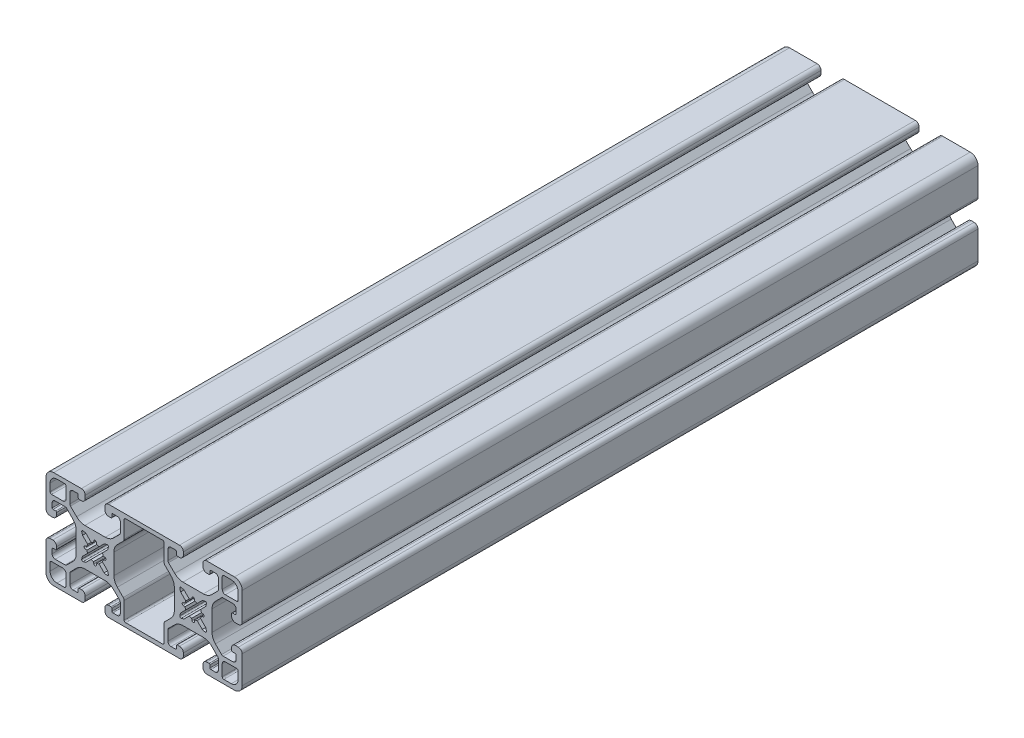
from build123d import *

# Parameters (mm, degrees)
EXTRUDE1_DEPTH = 300


with BuildPart() as part:
    # Sketch1 → Extrude1 (new body)
    with BuildSketch(Plane.XY):
        with BuildLine():
            Line((-44, -18.484793301), (-44, -17.255))
            ThreePointArc((-44, -17.255), (-44.459842354, -16.144842354), (-45.57, -15.685))
            Line((-45.57, -15.685), (-46.474, -15.685))
            ThreePointArc((-46.474, -15.685), (-46.743407684, -15.796592316), (-46.855, -16.066))
            Line((-46.855, -16.066), (-46.855, -17.119))
            ThreePointArc((-46.855, -17.119), (-46.966592316, -17.388407684), (-47.236, -17.5))
            Line((-47.236, -17.5), (-49.015, -17.5))
            ThreePointArc((-49.015, -17.5), (-49.913025612, -17.128025612), (-50.285, -16.23))
            Line((-50.285, -16.23), (-50.285, -12.216214636))
            ThreePointArc((-50.285, -12.216214636), (-50.217252784, -11.875626381), (-50.024325035, -11.5868896))
            Line((-50.024325035, -11.5868896), (-47.513678224, -9.076242789))
            ThreePointArc((-47.513678224, -9.076242789), (-45.972667317, -8.046572221), (-44.154921014, -7.685))
            Line((-44.154921014, -7.685), (-35.845078986, -7.685))
            ThreePointArc((-35.845078986, -7.685), (-34.027332683, -8.046572221), (-32.486321776, -9.076242789))
            Line((-32.486321776, -9.076242789), (-29.975674965, -11.5868896))
            ThreePointArc((-29.975674965, -11.5868896), (-29.782747216, -11.875626381), (-29.715, -12.216214636))
            Line((-29.715, -12.216214636), (-29.715, -16.23))
            ThreePointArc((-29.715, -16.23), (-30.086974388, -17.128025612), (-30.985, -17.5))
            Line((-30.985, -17.5), (-32.764, -17.5))
            ThreePointArc((-32.764, -17.5), (-33.033407684, -17.388407684), (-33.145, -17.119))
            Line((-33.145, -17.119), (-33.145, -16.066))
            ThreePointArc((-33.145, -16.066), (-33.256592316, -15.796592316), (-33.526, -15.685))
            Line((-33.526, -15.685), (-34.43, -15.685))
            ThreePointArc((-34.43, -15.685), (-35.540157646, -16.144842354), (-36, -17.255))
            Line((-36, -17.255), (-36, -18.484793301))
            ThreePointArc((-36, -18.484793301), (-35.521569689, -19.559363866), (-34.43095644, -20))
            Line((-34.43095644, -20), (-5.57, -20))
            ThreePointArc((-5.57, -20), (-4.459842354, -19.540157646), (-4, -18.43))
            Line((-4, -18.43), (-4, -17.255))
            ThreePointArc((-4, -17.255), (-4.459842354, -16.144842354), (-5.57, -15.685))
            Line((-5.57, -15.685), (-6.474, -15.685))
            ThreePointArc((-6.474, -15.685), (-6.743407684, -15.796592316), (-6.855, -16.066))
            Line((-6.855, -16.066), (-6.855, -17.119))
            ThreePointArc((-6.855, -17.119), (-6.966592316, -17.388407684), (-7.236, -17.5))
            Line((-7.236, -17.5), (-9.015, -17.5))
            ThreePointArc((-9.015, -17.5), (-9.913025612, -17.128025612), (-10.285, -16.23))
            Line((-10.285, -16.23), (-10.285, -12.216214636))
            ThreePointArc((-10.285, -12.216214636), (-10.217252784, -11.875626381), (-10.024325035, -11.5868896))
            Line((-10.024325035, -11.5868896), (-7.513678224, -9.076242789))
            ThreePointArc((-7.513678224, -9.076242789), (-5.972667317, -8.046572221), (-4.154921014, -7.685))
            Line((-4.154921014, -7.685), (4.154921014, -7.685))
            ThreePointArc((4.154921014, -7.685), (5.972667317, -8.046572221), (7.513678224, -9.076242789))
            Line((7.513678224, -9.076242789), (10.024325035, -11.5868896))
            ThreePointArc((10.024325035, -11.5868896), (10.217252784, -11.875626381), (10.285, -12.216214636))
            Line((10.285, -12.216214636), (10.285, -16.23))
            ThreePointArc((10.285, -16.23), (9.913025612, -17.128025612), (9.015, -17.5))
            Line((9.015, -17.5), (7.236, -17.5))
            ThreePointArc((7.236, -17.5), (6.966592316, -17.388407684), (6.855, -17.119))
            Line((6.855, -17.119), (6.855, -16.066))
            ThreePointArc((6.855, -16.066), (6.743407684, -15.796592316), (6.474, -15.685))
            Line((6.474, -15.685), (5.57, -15.685))
            ThreePointArc((5.57, -15.685), (4.459842354, -16.144842354), (4, -17.255))
            Line((4, -17.255), (4, -18.43))
            ThreePointArc((4, -18.43), (4.459842354, -19.540157646), (5.57, -20))
            Line((5.57, -20), (16.83, -20))
            ThreePointArc((16.83, -20), (19.071528496, -19.071528496), (20, -16.83))
            Line((20, -16.83), (20, -5.57))
            ThreePointArc((20, -5.57), (19.540157646, -4.459842354), (18.43, -4))
            Line((18.43, -4), (17.255, -4))
            ThreePointArc((17.255, -4), (16.144842354, -4.459842354), (15.685, -5.57))
            Line((15.685, -5.57), (15.685, -6.474))
            ThreePointArc((15.685, -6.474), (15.796592316, -6.743407684), (16.066, -6.855))
            Line((16.066, -6.855), (17.119, -6.855))
            ThreePointArc((17.119, -6.855), (17.388407684, -6.966592316), (17.5, -7.236))
            Line((17.5, -7.236), (17.5, -9.015))
            ThreePointArc((17.5, -9.015), (17.128025612, -9.913025612), (16.23, -10.285))
            Line((16.23, -10.285), (12.216214636, -10.285))
            ThreePointArc((12.216214636, -10.285), (11.875626381, -10.217252784), (11.5868896, -10.024325035))
            Line((11.5868896, -10.024325035), (9.076242789, -7.513678224))
            ThreePointArc((9.076242789, -7.513678224), (8.046572221, -5.972667317), (7.685, -4.154921014))
            Line((7.685, -4.154921014), (7.685, 4.154921014))
            ThreePointArc((7.685, 4.154921014), (8.046572221, 5.972667317), (9.076242789, 7.513678224))
            Line((9.076242789, 7.513678224), (11.5868896, 10.024325035))
            ThreePointArc((11.5868896, 10.024325035), (11.875626381, 10.217252784), (12.216214636, 10.285))
            Line((12.216214636, 10.285), (16.23, 10.285))
            ThreePointArc((16.23, 10.285), (17.128025612, 9.913025612), (17.5, 9.015))
            Line((17.5, 9.015), (17.5, 7.236))
            ThreePointArc((17.5, 7.236), (17.388407684, 6.966592316), (17.119, 6.855))
            Line((17.119, 6.855), (16.066, 6.855))
            ThreePointArc((16.066, 6.855), (15.796592316, 6.743407684), (15.685, 6.474))
            Line((15.685, 6.474), (15.685, 5.57))
            ThreePointArc((15.685, 5.57), (16.144842354, 4.459842354), (17.255, 4))
            Line((17.255, 4), (18.43, 4))
            ThreePointArc((18.43, 4), (19.540157646, 4.459842354), (20, 5.57))
            Line((20, 5.57), (20, 16.83))
            ThreePointArc((20, 16.83), (19.071528496, 19.071528496), (16.83, 20))
            Line((16.83, 20), (5.57, 20))
            ThreePointArc((5.57, 20), (4.459842354, 19.540157646), (4, 18.43))
            Line((4, 18.43), (4, 17.255))
            ThreePointArc((4, 17.255), (4.459842354, 16.144842354), (5.57, 15.685))
            Line((5.57, 15.685), (6.474, 15.685))
            ThreePointArc((6.474, 15.685), (6.743407684, 15.796592316), (6.855, 16.066))
            Line((6.855, 16.066), (6.855, 17.119))
            ThreePointArc((6.855, 17.119), (6.966592316, 17.388407684), (7.236, 17.5))
            Line((7.236, 17.5), (9.015, 17.5))
            ThreePointArc((9.015, 17.5), (9.913025612, 17.128025612), (10.285, 16.23))
            Line((10.285, 16.23), (10.285, 12.216214636))
            ThreePointArc((10.285, 12.216214636), (10.217252784, 11.875626381), (10.024325035, 11.5868896))
            Line((10.024325035, 11.5868896), (7.513678224, 9.076242789))
            ThreePointArc((7.513678224, 9.076242789), (5.972667317, 8.046572221), (4.154921014, 7.685))
            Line((4.154921014, 7.685), (-4.154921014, 7.685))
            ThreePointArc((-4.154921014, 7.685), (-5.972667317, 8.046572221), (-7.513678224, 9.076242789))
            Line((-7.513678224, 9.076242789), (-10.024325035, 11.5868896))
            ThreePointArc((-10.024325035, 11.5868896), (-10.217252784, 11.875626381), (-10.285, 12.216214636))
            Line((-10.285, 12.216214636), (-10.285, 16.23))
            ThreePointArc((-10.285, 16.23), (-9.913025612, 17.128025612), (-9.015, 17.5))
            Line((-9.015, 17.5), (-7.236, 17.5))
            ThreePointArc((-7.236, 17.5), (-6.966592316, 17.388407684), (-6.855, 17.119))
            Line((-6.855, 17.119), (-6.855, 16.066))
            ThreePointArc((-6.855, 16.066), (-6.743407684, 15.796592316), (-6.474, 15.685))
            Line((-6.474, 15.685), (-5.57, 15.685))
            ThreePointArc((-5.57, 15.685), (-4.459842354, 16.144842354), (-4, 17.255))
            Line((-4, 17.255), (-4, 18.43))
            ThreePointArc((-4, 18.43), (-4.459842354, 19.540157646), (-5.57, 20))
            Line((-5.57, 20), (-34.43, 20))
            ThreePointArc((-34.43, 20), (-35.540157646, 19.540157646), (-36, 18.43))
            Line((-36, 18.43), (-36, 17.255))
            ThreePointArc((-36, 17.255), (-35.540157646, 16.144842354), (-34.43, 15.685))
            Line((-34.43, 15.685), (-33.526, 15.685))
            ThreePointArc((-33.526, 15.685), (-33.256592316, 15.796592316), (-33.145, 16.066))
            Line((-33.145, 16.066), (-33.145, 17.119))
            ThreePointArc((-33.145, 17.119), (-33.033407684, 17.388407684), (-32.764, 17.5))
            Line((-32.764, 17.5), (-30.985, 17.5))
            ThreePointArc((-30.985, 17.5), (-30.086974388, 17.128025612), (-29.715, 16.23))
            Line((-29.715, 16.23), (-29.715, 12.216214636))
            ThreePointArc((-29.715, 12.216214636), (-29.782747216, 11.875626381), (-29.975674965, 11.5868896))
            Line((-29.975674965, 11.5868896), (-32.486321776, 9.076242789))
            ThreePointArc((-32.486321776, 9.076242789), (-34.027332683, 8.046572221), (-35.845078986, 7.685))
            Line((-35.845078986, 7.685), (-44.154921014, 7.685))
            ThreePointArc((-44.154921014, 7.685), (-45.972667317, 8.046572221), (-47.513678224, 9.076242789))
            Line((-47.513678224, 9.076242789), (-50.024325035, 11.5868896))
            ThreePointArc((-50.024325035, 11.5868896), (-50.217252784, 11.875626381), (-50.285, 12.216214636))
            Line((-50.285, 12.216214636), (-50.285, 16.23))
            ThreePointArc((-50.285, 16.23), (-49.913025612, 17.128025612), (-49.015, 17.5))
            Line((-49.015, 17.5), (-47.236, 17.5))
            ThreePointArc((-47.236, 17.5), (-46.966592316, 17.388407684), (-46.855, 17.119))
            Line((-46.855, 17.119), (-46.855, 16.066))
            ThreePointArc((-46.855, 16.066), (-46.743407684, 15.796592316), (-46.474, 15.685))
            Line((-46.474, 15.685), (-45.57, 15.685))
            ThreePointArc((-45.57, 15.685), (-44.459842354, 16.144842354), (-44, 17.255))
            Line((-44, 17.255), (-44, 18.43))
            ThreePointArc((-44, 18.43), (-44.459842354, 19.540157646), (-45.57, 20))
            Line((-45.57, 20), (-56.83, 20))
            ThreePointArc((-56.83, 20), (-59.071528496, 19.071528496), (-60, 16.83))
            Line((-60, 16.83), (-60, 5.57))
            ThreePointArc((-60, 5.57), (-59.540157646, 4.459842354), (-58.43, 4))
            Line((-58.43, 4), (-57.255, 4))
            ThreePointArc((-57.255, 4), (-56.144842354, 4.459842354), (-55.685, 5.57))
            Line((-55.685, 5.57), (-55.685, 6.474))
            ThreePointArc((-55.685, 6.474), (-55.796592316, 6.743407684), (-56.066, 6.855))
            Line((-56.066, 6.855), (-57.119, 6.855))
            ThreePointArc((-57.119, 6.855), (-57.388407684, 6.966592316), (-57.5, 7.236))
            Line((-57.5, 7.236), (-57.5, 9.015))
            ThreePointArc((-57.5, 9.015), (-57.128025612, 9.913025612), (-56.23, 10.285))
            Line((-56.23, 10.285), (-52.216214636, 10.285))
            ThreePointArc((-52.216214636, 10.285), (-51.875626381, 10.217252784), (-51.5868896, 10.024325035))
            Line((-51.5868896, 10.024325035), (-49.076242789, 7.513678224))
            ThreePointArc((-49.076242789, 7.513678224), (-48.046572221, 5.972667317), (-47.685, 4.154921014))
            Line((-47.685, 4.154921014), (-47.685, -4.154921014))
            ThreePointArc((-47.685, -4.154921014), (-48.046572221, -5.972667317), (-49.076242789, -7.513678224))
            Line((-49.076242789, -7.513678224), (-51.5868896, -10.024325035))
            ThreePointArc((-51.5868896, -10.024325035), (-51.875626381, -10.217252784), (-52.216214636, -10.285))
            Line((-52.216214636, -10.285), (-56.23, -10.285))
            ThreePointArc((-56.23, -10.285), (-57.128025612, -9.913025612), (-57.5, -9.015))
            Line((-57.5, -9.015), (-57.5, -7.236))
            ThreePointArc((-57.5, -7.236), (-57.388407684, -6.966592316), (-57.119, -6.855))
            Line((-57.119, -6.855), (-56.066, -6.855))
            ThreePointArc((-56.066, -6.855), (-55.796592316, -6.743407684), (-55.685, -6.474))
            Line((-55.685, -6.474), (-55.685, -5.57))
            ThreePointArc((-55.685, -5.57), (-56.144842354, -4.459842354), (-57.255, -4))
            Line((-57.255, -4), (-58.43, -4))
            ThreePointArc((-58.43, -4), (-59.540157646, -4.459842354), (-60, -5.57))
            Line((-60, -5.57), (-60, -16.83))
            ThreePointArc((-60, -16.83), (-59.071528496, -19.071528496), (-56.83, -20))
            Line((-56.83, -20), (-45.56904356, -20))
            ThreePointArc((-45.56904356, -20), (-44.478430311, -19.559363866), (-44, -18.484793301))
        make_face()
        with BuildLine():
            Line((15.545, -18.345), (12.4898, -18.345))
            ThreePointArc((12.4898, -18.345), (12.044322728, -18.160477272), (11.8598, -17.715))
            Line((11.8598, -17.715), (11.8598, -13.1298))
            ThreePointArc((11.8598, -13.1298), (12.231774388, -12.231774388), (13.1298, -11.8598))
            Line((13.1298, -11.8598), (17.715, -11.8598))
            ThreePointArc((17.715, -11.8598), (18.160477272, -12.044322728), (18.345, -12.4898))
            Line((18.345, -12.4898), (18.345, -15.545))
            ThreePointArc((18.345, -15.545), (17.524898987, -17.524898987), (15.545, -18.345))
        make_face(mode=Mode.SUBTRACT)
        with BuildLine():
            Line((-11.8598, 17.715), (-11.8598, 10.823286659))
            ThreePointArc((-11.8598, 10.823286659), (-11.763127006, 10.3372787), (-11.487825612, 9.925261047))
            Line((-11.487825612, 9.925261047), (-9.076242789, 7.513678224))
            ThreePointArc((-9.076242789, 7.513678224), (-8.046572221, 5.972667317), (-7.685, 4.154921014))
            Line((-7.685, 4.154921014), (-7.685, -4.154921014))
            ThreePointArc((-7.685, -4.154921014), (-8.046572221, -5.972667317), (-9.076242789, -7.513678224))
            Line((-9.076242789, -7.513678224), (-11.487825612, -9.925261047))
            ThreePointArc((-11.487825612, -9.925261047), (-11.763127006, -10.3372787), (-11.8598, -10.823286659))
            Line((-11.8598, -10.823286659), (-11.8598, -17.715))
            ThreePointArc((-11.8598, -17.715), (-12.044322728, -18.160477272), (-12.4898, -18.345))
            Line((-12.4898, -18.345), (-27.5102, -18.345))
            ThreePointArc((-27.5102, -18.345), (-27.955677272, -18.160477272), (-28.1402, -17.715))
            Line((-28.1402, -17.715), (-28.1402, -10.823286659))
            ThreePointArc((-28.1402, -10.823286659), (-28.236872994, -10.3372787), (-28.512174388, -9.925261047))
            Line((-28.512174388, -9.925261047), (-30.923757211, -7.513678224))
            ThreePointArc((-30.923757211, -7.513678224), (-31.953427779, -5.972667317), (-32.315, -4.154921014))
            Line((-32.315, -4.154921014), (-32.315, 4.154921014))
            ThreePointArc((-32.315, 4.154921014), (-31.953427779, 5.972667317), (-30.923757211, 7.513678224))
            Line((-30.923757211, 7.513678224), (-28.512174388, 9.925261047))
            ThreePointArc((-28.512174388, 9.925261047), (-28.236872994, 10.3372787), (-28.1402, 10.823286659))
            Line((-28.1402, 10.823286659), (-28.1402, 17.715))
            ThreePointArc((-28.1402, 17.715), (-27.955677272, 18.160477272), (-27.5102, 18.345))
            Line((-27.5102, 18.345), (-12.4898, 18.345))
            ThreePointArc((-12.4898, 18.345), (-12.044322728, 18.160477272), (-11.8598, 17.715))
        make_face(mode=Mode.SUBTRACT)
        with BuildLine():
            Line((-58.345, -15.545), (-58.345, -12.4898))
            ThreePointArc((-58.345, -12.4898), (-58.160477272, -12.044322728), (-57.715, -11.8598))
            Line((-57.715, -11.8598), (-53.1298, -11.8598))
            ThreePointArc((-53.1298, -11.8598), (-52.231774388, -12.231774388), (-51.8598, -13.1298))
            Line((-51.8598, -13.1298), (-51.8598, -17.715))
            ThreePointArc((-51.8598, -17.715), (-52.044322728, -18.160477272), (-52.4898, -18.345))
            Line((-52.4898, -18.345), (-55.545, -18.345))
            ThreePointArc((-55.545, -18.345), (-57.524898987, -17.524898987), (-58.345, -15.545))
        make_face(mode=Mode.SUBTRACT)
        with BuildLine():
            Line((-55.545, 18.345), (-52.4898, 18.345))
            ThreePointArc((-52.4898, 18.345), (-52.044322728, 18.160477272), (-51.8598, 17.715))
            Line((-51.8598, 17.715), (-51.8598, 13.1298))
            ThreePointArc((-51.8598, 13.1298), (-52.231774388, 12.231774388), (-53.1298, 11.8598))
            Line((-53.1298, 11.8598), (-57.715, 11.8598))
            ThreePointArc((-57.715, 11.8598), (-58.160477272, 12.044322728), (-58.345, 12.4898))
            Line((-58.345, 12.4898), (-58.345, 15.545))
            ThreePointArc((-58.345, 15.545), (-57.524898987, 17.524898987), (-55.545, 18.345))
        make_face(mode=Mode.SUBTRACT)
        with BuildLine():
            Line((18.345, 15.545), (18.345, 12.4898))
            ThreePointArc((18.345, 12.4898), (18.160477272, 12.044322728), (17.715, 11.8598))
            Line((17.715, 11.8598), (13.1298, 11.8598))
            ThreePointArc((13.1298, 11.8598), (12.231774388, 12.231774388), (11.8598, 13.1298))
            Line((11.8598, 13.1298), (11.8598, 17.715))
            ThreePointArc((11.8598, 17.715), (12.044322728, 18.160477272), (12.4898, 18.345))
            Line((12.4898, 18.345), (15.545, 18.345))
            ThreePointArc((15.545, 18.345), (17.524898987, 17.524898987), (18.345, 15.545))
        make_face(mode=Mode.SUBTRACT)
        with BuildLine():
            Line((-34.873747818, -3.712038616), (-34.560690261, -4.84811685))
            ThreePointArc((-34.560690261, -4.84811685), (-34.696699139, -5.303300857), (-35.151883146, -5.43930974))
            Line((-35.151883146, -5.43930974), (-36.28796138, -5.126252183))
            Line((-36.28796138, -5.126252183), (-38.409281723, -3.00493184))
            ThreePointArc((-38.409281723, -3.00493184), (-38.879390357, -3.210020877), (-39.375, -3.34206149))
            Line((-39.375, -3.34206149), (-39.507740766, -4.087640441))
            ThreePointArc((-39.507740766, -4.087640441), (-40, -4.5), (-40.492259234, -4.087640441))
            Line((-40.492259234, -4.087640441), (-40.625, -3.34206149))
            ThreePointArc((-40.625, -3.34206149), (-41.120609643, -3.210020877), (-41.590718277, -3.00493184))
            Line((-41.590718277, -3.00493184), (-43.71203862, -5.126252183))
            Line((-43.71203862, -5.126252183), (-44.848116854, -5.43930974))
            ThreePointArc((-44.848116854, -5.43930974), (-45.303300871, -5.303300847), (-45.439309734, -4.848116822))
            Line((-45.439309734, -4.848116822), (-45.126252208, -3.712038579))
            Line((-45.126252208, -3.712038579), (-43.004931858, -1.590718243))
            ThreePointArc((-43.004931858, -1.590718243), (-43.210020883, -1.120609625), (-43.34206149, -0.625))
            Line((-43.34206149, -0.625), (-44.087640441, -0.492259234))
            ThreePointArc((-44.087640441, -0.492259234), (-44.5, 0), (-44.087640441, 0.492259234))
            Line((-44.087640441, 0.492259234), (-43.34206149, 0.625))
            ThreePointArc((-43.34206149, 0.625), (-43.210020877, 1.120609643), (-43.00493184, 1.590718277))
            Line((-43.00493184, 1.590718277), (-45.126252183, 3.71203862))
            Line((-45.126252183, 3.71203862), (-45.43930974, 4.848116854))
            ThreePointArc((-45.43930974, 4.848116854), (-45.303300847, 5.303300871), (-44.848116822, 5.439309734))
            Line((-44.848116822, 5.439309734), (-43.712038579, 5.126252209))
            Line((-43.712038579, 5.126252209), (-41.590718243, 3.004931858))
            ThreePointArc((-41.590718243, 3.004931858), (-41.120609625, 3.210020883), (-40.625, 3.34206149))
            Line((-40.625, 3.34206149), (-40.492259234, 4.087640441))
            ThreePointArc((-40.492259234, 4.087640441), (-40, 4.5), (-39.507740766, 4.087640441))
            Line((-39.507740766, 4.087640441), (-39.375, 3.34206149))
            ThreePointArc((-39.375, 3.34206149), (-38.879390364, 3.210020879), (-38.409281735, 3.004931846))
            Line((-38.409281735, 3.004931846), (-36.287961384, 5.126252182))
            Line((-36.287961384, 5.126252182), (-35.15188315, 5.43930974))
            ThreePointArc((-35.15188315, 5.43930974), (-34.696699143, 5.303300861), (-34.56069026, 4.848116854))
            Line((-34.56069026, 4.848116854), (-34.873747817, 3.71203862))
            Line((-34.873747817, 3.71203862), (-36.99506816, 1.590718277))
            ThreePointArc((-36.99506816, 1.590718277), (-36.789979123, 1.120609643), (-36.65793851, 0.625))
            Line((-36.65793851, 0.625), (-35.912359559, 0.492259234))
            ThreePointArc((-35.912359559, 0.492259234), (-35.5, 0), (-35.912359559, -0.492259234))
            Line((-35.912359559, -0.492259234), (-36.65793851, -0.625))
            ThreePointArc((-36.65793851, -0.625), (-36.789979121, -1.120609636), (-36.995068154, -1.590718265))
            Line((-36.995068154, -1.590718265), (-34.873747818, -3.712038616))
        make_face(mode=Mode.SUBTRACT)
        with BuildLine():
            Line((5.126252183, -3.712038621), (5.43930974, -4.848116855))
            ThreePointArc((5.43930974, -4.848116855), (5.303300859, -5.303300859), (4.848116855, -5.439309741))
            Line((4.848116855, -5.439309741), (3.712038621, -5.126252182))
            Line((3.712038621, -5.126252182), (1.590718278, -3.00493184))
            ThreePointArc((1.590718278, -3.00493184), (1.120609643, -3.210020877), (0.625, -3.34206149))
            Line((0.625, -3.34206149), (0.492259234, -4.087640441))
            ThreePointArc((0.492259234, -4.087640441), (0, -4.5), (-0.492259234, -4.087640441))
            Line((-0.492259234, -4.087640441), (-0.625, -3.34206149))
            ThreePointArc((-0.625, -3.34206149), (-1.120609643, -3.210020877), (-1.590718277, -3.00493184))
            Line((-1.590718277, -3.00493184), (-3.71203862, -5.126252183))
            Line((-3.71203862, -5.126252183), (-4.848116854, -5.43930974))
            ThreePointArc((-4.848116854, -5.43930974), (-5.30330086, -5.30330086), (-5.439309742, -4.848116855))
            Line((-5.439309742, -4.848116855), (-5.126252183, -3.712038621))
            Line((-5.126252183, -3.712038621), (-3.004931839, -1.590718279))
            ThreePointArc((-3.004931839, -1.590718279), (-3.210020876, -1.120609644), (-3.34206149, -0.625))
            Line((-3.34206149, -0.625), (-4.087640441, -0.492259234))
            ThreePointArc((-4.087640441, -0.492259234), (-4.5, 0), (-4.087640441, 0.492259234))
            Line((-4.087640441, 0.492259234), (-3.34206149, 0.625))
            ThreePointArc((-3.34206149, 0.625), (-3.210020877, 1.120609643), (-3.00493184, 1.590718277))
            Line((-3.00493184, 1.590718277), (-5.126252183, 3.71203862))
            Line((-5.126252183, 3.71203862), (-5.439309741, 4.848116854))
            ThreePointArc((-5.439309741, 4.848116854), (-5.303300859, 5.303300859), (-4.848116854, 5.43930974))
            Line((-4.848116854, 5.43930974), (-3.712038621, 5.126252183))
            Line((-3.712038621, 5.126252183), (-1.590718277, 3.00493184))
            ThreePointArc((-1.590718277, 3.00493184), (-1.120609643, 3.210020877), (-0.625, 3.34206149))
            Line((-0.625, 3.34206149), (-0.492259234, 4.087640441))
            ThreePointArc((-0.492259234, 4.087640441), (0, 4.5), (0.492259234, 4.087640441))
            Line((0.492259234, 4.087640441), (0.625, 3.34206149))
            ThreePointArc((0.625, 3.34206149), (1.120609646, 3.210020876), (1.590718283, 3.004931837))
            Line((1.590718283, 3.004931837), (3.712038628, 5.126252178))
            Line((3.712038628, 5.126252178), (4.84811686, 5.439309741))
            ThreePointArc((4.84811686, 5.439309741), (5.303300861, 5.303300856), (5.43930974, 4.848116854))
            Line((5.43930974, 4.848116854), (5.126252183, 3.71203862))
            Line((5.126252183, 3.71203862), (3.00493184, 1.590718277))
            ThreePointArc((3.00493184, 1.590718277), (3.210020877, 1.120609643), (3.34206149, 0.625))
            Line((3.34206149, 0.625), (4.087640441, 0.492259234))
            ThreePointArc((4.087640441, 0.492259234), (4.5, 0), (4.087640441, -0.492259234))
            Line((4.087640441, -0.492259234), (3.34206149, -0.625))
            ThreePointArc((3.34206149, -0.625), (3.210020877, -1.120609643), (3.00493184, -1.590718278))
            Line((3.00493184, -1.590718278), (5.126252183, -3.712038621))
        make_face(mode=Mode.SUBTRACT)
    extrude(amount=-EXTRUDE1_DEPTH)


solid = part.part
